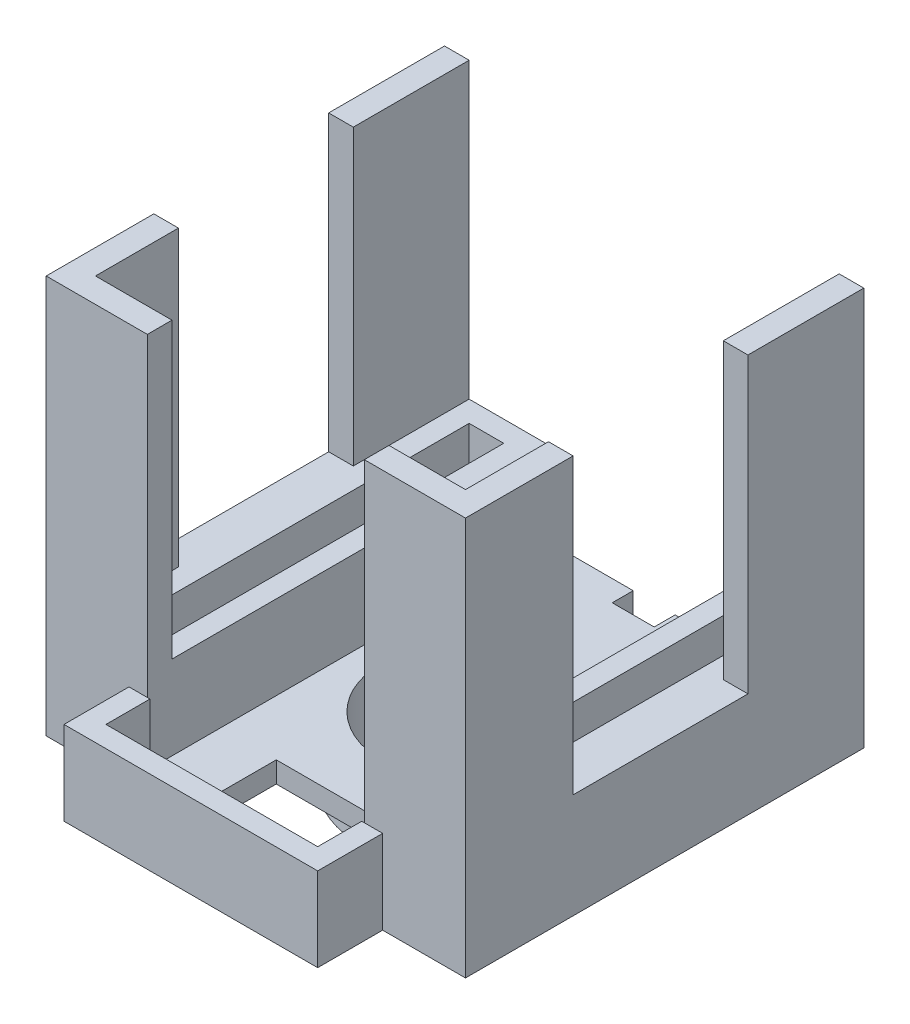
from build123d import *

# Parameters (mm, degrees)
BOSS_EXTRUDE2_DEPTH = 28
SKETCH3_W           = 40
SKETCH3_H           = 38
BOSS_EXTRUDE3_DEPTH = 10
CUT_EXTRUDE2_DEPTH  = 8
SKETCH6_W           = 20.7
SKETCH6_H           = 38
CUT_EXTRUDE3_DEPTH  = 43
CUT_EXTRUDE4_DEPTH  = 43
BOSS_EXTRUDE5_DEPTH = 8
SKETCH10_R          = 10
BOSS_EXTRUDE6_DEPTH = 4
SKETCH11_R          = 8
CUT_EXTRUDE5_DEPTH  = 4
SKETCH12_R          = 8
CUT_EXTRUDE6_DEPTH  = 10
SKETCH13_W          = 3.3
SKETCH13_H          = 31.65
CUT_EXTRUDE7_DEPTH  = 10
SKETCH14_W          = 3.3
SKETCH14_H          = 31.65
CUT_EXTRUDE8_DEPTH  = 10
SKETCH15_W          = 16.679991472
SKETCH15_H          = 28
CUT_EXTRUDE9_DEPTH  = 253
SKETCH16_W          = 10.1
SKETCH16_H          = 7
CUT_EXTRUDE11_DEPTH = 13


with BuildPart() as part:
    # Sketch1 → Boss-Extrude2 (new body)
    with BuildSketch(Plane(origin=(0, 0, 0), x_dir=(1, 0, 0), z_dir=(0, 1, 0))):
        Polygon((40, -2), (40, -40), (0, -40), (0, -2), (2.35, -2), (2.35, -2.35), (2.35, -20), (2.35, -37.65), (37.65, -37.65), (37.65, -20), (37.65, -2.35), (37.65, -2), align=None)
    extrude(amount=BOSS_EXTRUDE2_DEPTH)

    # Sketch3 → Boss-Extrude3 (add)
    with BuildSketch(Plane.XZ):
        with Locations((20, 21)):
            Rectangle(SKETCH3_W, SKETCH3_H)
    extrude(amount=BOSS_EXTRUDE3_DEPTH)

    # Sketch5 → Cut-Extrude2 (cut)
    with BuildSketch(Plane(origin=(0, 0, 0), x_dir=(1, 0, 0), z_dir=(0, 1, 0))):
        Polygon((9.65, -20), (9.65, -57.9), (20, -57.9), (30.35, -57.9), (30.35, -20), (30.35, -2), (9.65, -2), align=None)
    extrude(amount=-CUT_EXTRUDE2_DEPTH, mode=Mode.SUBTRACT)

    # Sketch6 → Cut-Extrude3 (cut)
    with BuildSketch(Plane(origin=(0, -8, 0), x_dir=(1, 0, 0), z_dir=(0, 1, 0))):
        with Locations((20, -21)):
            Rectangle(SKETCH6_W, SKETCH6_H)
    extrude(amount=CUT_EXTRUDE3_DEPTH, mode=Mode.SUBTRACT)

    # Sketch7 → Cut-Extrude4 (cut)
    with BuildSketch(Plane(origin=(0, -8, 0), x_dir=(1, 0, 0), z_dir=(0, 1, 0))):
        Polygon((20, -4), (18, -4), (18, -2), (22, -2), (22, -4), align=None)
    extrude(amount=-CUT_EXTRUDE4_DEPTH, mode=Mode.SUBTRACT)

    # Sketch9 → Boss-Extrude5 (add)
    with BuildSketch(Plane.XZ.offset(10)):
        Polygon((30.1, 44.2), (30.1, 40), (32.1, 40), (32.1, 46.2), (18, 46.2), (9.9, 46.2), (7.9, 46.2), (7.9, 40), (9.9, 40), (9.9, 44.2), align=None)
    extrude(amount=-BOSS_EXTRUDE5_DEPTH)

    # Sketch10 → Boss-Extrude6 (add)
    with BuildSketch(Plane.XZ.offset(10)):
        with Locations(Location((20, 20, 0), (0, 0, 270))):
            Circle(SKETCH10_R)
    extrude(amount=BOSS_EXTRUDE6_DEPTH)

    # Sketch11 → Cut-Extrude5 (cut)
    with BuildSketch(Plane(origin=(0, -14, 0), x_dir=(-1, 0, 0), z_dir=(0, -1, 0))):
        with Locations(Location((-20, -20, 0), (0, 0, 90))):
            Circle(SKETCH11_R)
    extrude(amount=-CUT_EXTRUDE5_DEPTH, mode=Mode.SUBTRACT)

    # Sketch12 → Cut-Extrude6 (cut)
    with BuildSketch(Plane.XZ.offset(10)):
        with Locations(Location((20, 20, 0), (0, 0, 270))):
            Circle(SKETCH12_R)
    extrude(amount=-CUT_EXTRUDE6_DEPTH, mode=Mode.SUBTRACT)

    # Sketch13 → Cut-Extrude7 (cut)
    with BuildSketch(Plane(origin=(0, 0, 0), x_dir=(1, 0, 0), z_dir=(0, 1, 0))):
        with Locations((6, -19.825)):
            Rectangle(SKETCH13_W, SKETCH13_H)
    extrude(amount=-CUT_EXTRUDE7_DEPTH, mode=Mode.SUBTRACT)

    # Sketch14 → Cut-Extrude8 (cut)
    with BuildSketch(Plane(origin=(0, 0, 0), x_dir=(1, 0, 0), z_dir=(0, 1, 0))):
        with Locations((34, -19.825)):
            Rectangle(SKETCH14_W, SKETCH14_H)
    extrude(amount=-CUT_EXTRUDE8_DEPTH, mode=Mode.SUBTRACT)

    # Sketch15 → Cut-Extrude9 (cut)
    with BuildSketch(Plane(origin=(40, 0, 0), x_dir=(0, 0, -1), z_dir=(1, 0, 0))):
        with Locations((-21.392853586, 14)):
            Rectangle(SKETCH15_W, SKETCH15_H)
    extrude(amount=-CUT_EXTRUDE9_DEPTH, mode=Mode.SUBTRACT)

    # Sketch16 → Cut-Extrude11 (cut)
    with BuildSketch(Plane.XZ.offset(10)):
        with Locations((20, 36.5)):
            Rectangle(SKETCH16_W, SKETCH16_H)
    extrude(amount=-CUT_EXTRUDE11_DEPTH, mode=Mode.SUBTRACT)


solid = part.part
